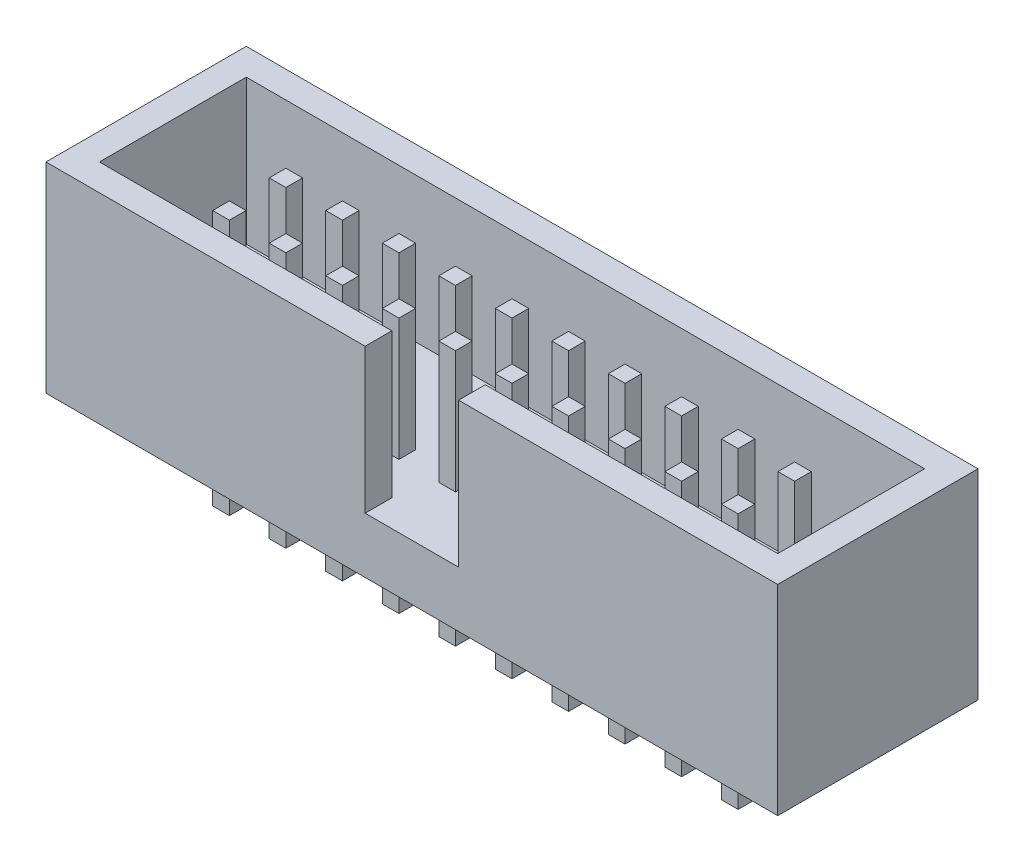
from build123d import *

# Parameters (mm, degrees)
SKETCH_1_W           = 32.88
SKETCH_1_H           = 9
EXTRUDE_1_DEPTH      = 9
SKETCH_2_W           = 30.48
SKETCH_2_H           = 6.6
CUT_EXTRUDE_1_DEPTH  = 6.5
SKETCH_3_W           = 4.2
SKETCH_3_H           = 6.5
CUT_EXTRUDE_2_DEPTH  = 6.5
EXTRUDE_2_DEPTH      = 3.5
EXTRUDE_2_DEPTH_BACK = 8
SKETCH_5_W           = 0.75
SKETCH_5_H           = 0.75


with BuildPart() as part:
    # 草图1 → 拉伸1 (new body)
    with BuildSketch(Plane(origin=(0, 0, 0), x_dir=(1, 0, 0), z_dir=(0, 1, 0))):
        Rectangle(SKETCH_1_W, SKETCH_1_H)
    extrude(amount=EXTRUDE_1_DEPTH)

    # 草图2 → 切除-拉伸1 (cut)
    with BuildSketch(Plane(origin=(0, 9, 0), x_dir=(-1, 0, 0), z_dir=(0, 1, 0))):
        Rectangle(SKETCH_2_W, SKETCH_2_H)
    extrude(amount=-CUT_EXTRUDE_1_DEPTH, mode=Mode.SUBTRACT)

    # 草图3 → 切除-拉伸2 (cut)
    with BuildSketch(Plane.XY.offset(4.5)):
        with Locations((0, 5.75)):
            Rectangle(SKETCH_3_W, SKETCH_3_H)
    extrude(amount=-CUT_EXTRUDE_2_DEPTH, mode=Mode.SUBTRACT)

    # 草图5 → 拉伸2 (add, two sides: drawn at the far end of the back side and taken through both)
    with BuildSketch(Plane.XZ.offset(-EXTRUDE_2_DEPTH_BACK)):
        with Locations((-1.27, 1.27)):
            Rectangle(SKETCH_5_W, SKETCH_5_H)
        with Locations((1.27, 1.27)):
            Rectangle(SKETCH_5_W, SKETCH_5_H)
        with Locations((3.81, 1.27)):
            Rectangle(SKETCH_5_W, SKETCH_5_H)
        with Locations((6.35, 1.27)):
            Rectangle(SKETCH_5_W, SKETCH_5_H)
        with Locations((8.89, 1.27)):
            Rectangle(SKETCH_5_W, SKETCH_5_H)
        with Locations((11.43, 1.27)):
            Rectangle(SKETCH_5_W, SKETCH_5_H)
        with Locations((1.27, -1.27)):
            Rectangle(SKETCH_5_W, SKETCH_5_H)
        with Locations((3.81, -1.27)):
            Rectangle(SKETCH_5_W, SKETCH_5_H)
        with Locations((6.35, -1.27)):
            Rectangle(SKETCH_5_W, SKETCH_5_H)
        with Locations((8.89, -1.27)):
            Rectangle(SKETCH_5_W, SKETCH_5_H)
        with Locations((11.43, -1.27)):
            Rectangle(SKETCH_5_W, SKETCH_5_H)
        with Locations((-3.81, 1.27)):
            Rectangle(SKETCH_5_W, SKETCH_5_H)
        with Locations((-6.35, 1.27)):
            Rectangle(SKETCH_5_W, SKETCH_5_H)
        with Locations((-8.89, 1.27)):
            Rectangle(SKETCH_5_W, SKETCH_5_H)
        with Locations((-11.43, 1.27)):
            Rectangle(SKETCH_5_W, SKETCH_5_H)
        with Locations((-1.27, -1.27)):
            Rectangle(SKETCH_5_W, SKETCH_5_H)
        with Locations((-3.81, -1.27)):
            Rectangle(SKETCH_5_W, SKETCH_5_H)
        with Locations((-6.35, -1.27)):
            Rectangle(SKETCH_5_W, SKETCH_5_H)
        with Locations((-8.89, -1.27)):
            Rectangle(SKETCH_5_W, SKETCH_5_H)
        with Locations((-11.43, -1.27)):
            Rectangle(SKETCH_5_W, SKETCH_5_H)
    extrude(amount=EXTRUDE_2_DEPTH + EXTRUDE_2_DEPTH_BACK)


solid = part.part
